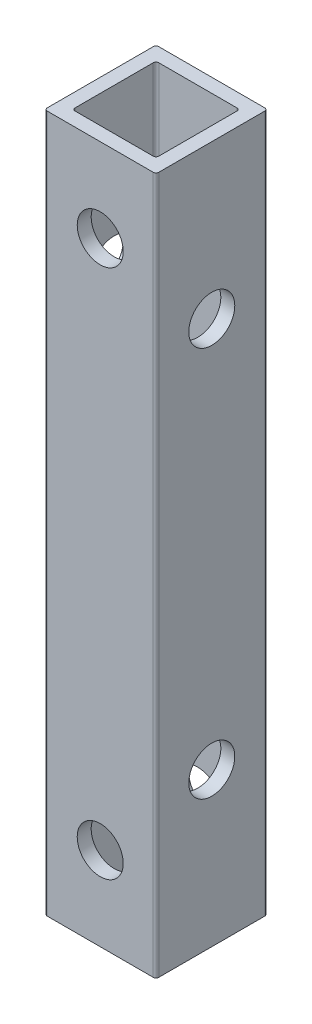
from build123d import *

# Parameters (mm, degrees)
SKETCH_1_W          = 8
SKETCH_1_H          = 8
SKETCH_1_W_2        = 6
SKETCH_1_H_2        = 6
EXTRUDE_1_DEPTH     = 50
FILLET_1_R          = 0.2
FILLET_2_R          = 0.2
SKETCH_3_R          = 1.65
CUT_EXTRUDE_1_DEPTH = 50
SKETCH_4_R          = 1.65
CUT_EXTRUDE_2_DEPTH = 50


with BuildPart() as part:
    # 草图1 → 凸台-拉伸1 (new body)
    with BuildSketch(Plane(origin=(0, 0, 0), x_dir=(1, 0, 0), z_dir=(0, 1, 0))):
        Rectangle(SKETCH_1_W, SKETCH_1_H)
        Rectangle(SKETCH_1_W_2, SKETCH_1_H_2, mode=Mode.SUBTRACT)
    extrude(amount=EXTRUDE_1_DEPTH)

    # 圆角1
    fillet_1_edges = [part.edges().sort_by_distance(p)[0] for p in [
        (3, 25, 3),
        (3, 25, -3),
        (-3, 25, -3),
        (-3, 25, 3),
    ]]
    fillet(fillet_1_edges, radius=FILLET_1_R)

    # 圆角2
    fillet_2_edges = [part.edges().sort_by_distance(p)[0] for p in [
        (4, 25, 4),
        (-4, 25, 4),
        (-4, 25, -4),
        (4, 25, -4),
    ]]
    fillet(fillet_2_edges, radius=FILLET_2_R)

    # 草图3 → 切除-拉伸1 (cut)
    with BuildSketch(Plane(origin=(4, 0, 0), x_dir=(0, 0, -1), z_dir=(1, 0, 0))):
        with Locations((0, 39)):
            Circle(SKETCH_3_R)
        with Locations((0, 11)):
            Circle(SKETCH_3_R)
    extrude(amount=-CUT_EXTRUDE_1_DEPTH, mode=Mode.SUBTRACT)

    # 草图4 → 切除-拉伸2 (cut)
    with BuildSketch(Plane(origin=(0, 0, -4), x_dir=(-1, 0, 0), z_dir=(0, 0, -1))):
        with Locations((0, 44)):
            Circle(SKETCH_4_R)
        with Locations((0, 6)):
            Circle(SKETCH_4_R)
    extrude(amount=-CUT_EXTRUDE_2_DEPTH, mode=Mode.SUBTRACT)


solid = part.part
